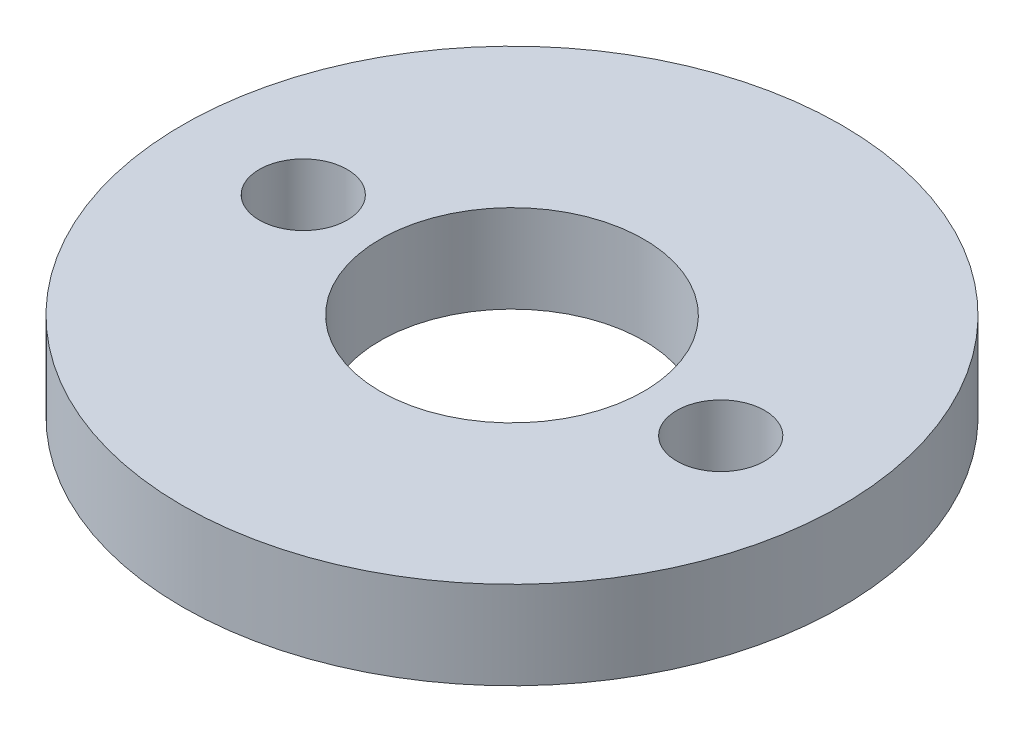
from build123d import *

# Parameters (mm, degrees)
SKETCH1_R           = 15
BOSS_EXTRUDE1_DEPTH = 4
SKETCH2_R           = 6
CUT_EXTRUDE1_DEPTH  = 22.587033145
SKETCH3_R           = 2
CUT_EXTRUDE2_DEPTH  = 22.587033145


with BuildPart() as part:
    # Sketch1 → Boss-Extrude1 (new body)
    with BuildSketch(Plane(origin=(0, 0, 0), x_dir=(1, 0, 0), z_dir=(0, 1, 0))):
        with Locations(Location((0, 0, 0), (0, 0, 270))):
            Circle(SKETCH1_R)
    extrude(amount=BOSS_EXTRUDE1_DEPTH)

    # Sketch2 → Cut-Extrude1 (cut, through all)
    with BuildSketch(Plane(origin=(0, 4, 0), x_dir=(1, 0, 0), z_dir=(0, 1, 0))):
        with Locations(Location((0, 0, 0), (0, 0, 270))):
            Circle(SKETCH2_R)
    extrude(amount=-CUT_EXTRUDE1_DEPTH, mode=Mode.SUBTRACT)

    # Sketch3 → Cut-Extrude2 (cut, through all)
    with BuildSketch(Plane(origin=(0, 4, 0), x_dir=(1, 0, 0), z_dir=(0, 1, 0))):
        with Locations(Location((-9.5, 0, 0), (0, 0, 270))):
            Circle(SKETCH3_R)
        with Locations(Location((9.5, 0, 0), (0, 0, 90))):
            Circle(SKETCH3_R)
    extrude(amount=-CUT_EXTRUDE2_DEPTH, mode=Mode.SUBTRACT)


solid = part.part
